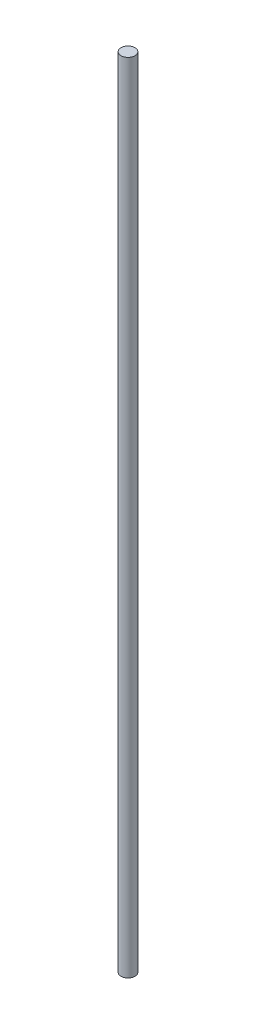
from build123d import *

# Parameters (mm, degrees)
SKETCH1_R           = 4
BOSS_EXTRUDE1_DEPTH = 457.2


with BuildPart() as part:
    # Sketch1 → Boss-Extrude1 (new body)
    with BuildSketch(Plane(origin=(0, 0, 0), x_dir=(1, 0, 0), z_dir=(0, 1, 0))):
        with Locations(Location((0, 0, 0), (0, 0, 270))):
            Circle(SKETCH1_R)
    extrude(amount=BOSS_EXTRUDE1_DEPTH)


solid = part.part
